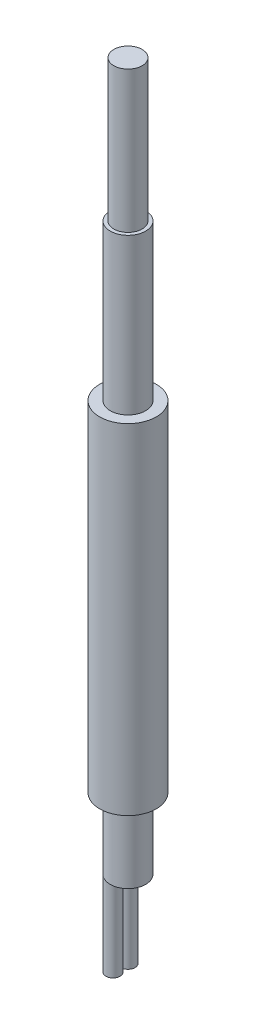
from build123d import *

# Parameters (mm, degrees)
SKIZZE1_R                            = 0.625
SKIZZE1_R_2                          = 0.5
AUFSATZ_LINEAR_AUSTRAGEN1_DEPTH      = 20
AUFSATZ_LINEAR_AUSTRAGEN2_DEPTH      = 5
AUFSATZ_LINEAR_AUSTRAGEN2_DEPTH_BACK = 20
SKIZZE2_R                            = 0.5
SKIZZE3_R                            = 1
SKIZZE3_R_2                          = 0.625
LINEAR_AUSTRAGEN_D_NN1_DEPTH         = 12
SKIZZE5_R                            = 0.25
AUFSATZ_LINEAR_AUSTRAGEN3_DEPTH      = 3


with BuildPart() as part:
    # Skizze1 → Aufsatz-Linear austragen1 (new body)
    with BuildSketch(Plane(origin=(0, 0, 0), x_dir=(1, 0, 0), z_dir=(0, 1, 0))):
        with Locations(Location((0, 0, 0), (0, 0, 270))):
            Circle(SKIZZE1_R)
        with Locations(Location((0, 0, 0), (0, 0, 270))):
            Circle(SKIZZE1_R_2, mode=Mode.SUBTRACT)
    extrude(amount=AUFSATZ_LINEAR_AUSTRAGEN1_DEPTH)

    # Skizze5 → Aufsatz-Linear austragen3 (add)
    with BuildSketch(Plane.XZ):
        with Locations(Location((-0.265165043, -0.265165043, 0), (0, 0, 149.477512186))):
            Circle(SKIZZE5_R)
        with Locations(Location((-0.265165043, 0.265165043, 0), (0, 0, 90))):
            Circle(SKIZZE5_R)
    extrude(amount=AUFSATZ_LINEAR_AUSTRAGEN3_DEPTH)


with BuildPart() as body_2:
    # Skizze2 → Aufsatz-Linear austragen2 (new, two sides: drawn at the far end of the back side and taken through both)
    with BuildSketch(Plane(origin=(0, 20, 0), x_dir=(1, 0, 0), z_dir=(0, 1, 0)).offset(-AUFSATZ_LINEAR_AUSTRAGEN2_DEPTH_BACK)):
        with Locations(Location((0, 0, 0), (0, 0, 270))):
            Circle(SKIZZE2_R)
    extrude(amount=AUFSATZ_LINEAR_AUSTRAGEN2_DEPTH + AUFSATZ_LINEAR_AUSTRAGEN2_DEPTH_BACK)


with BuildPart() as body_3:
    # Skizze3 → Linear-Austragen-Dünn1 (new body)
    with BuildSketch(Plane(origin=(0, 2.5, 0), x_dir=(1, 0, 0), z_dir=(0, 1, 0))):
        Circle(SKIZZE3_R)
        Circle(SKIZZE3_R_2, mode=Mode.SUBTRACT)
    extrude(amount=LINEAR_AUSTRAGEN_D_NN1_DEPTH)


solid = Compound([part.part, body_2.part, body_3.part])
